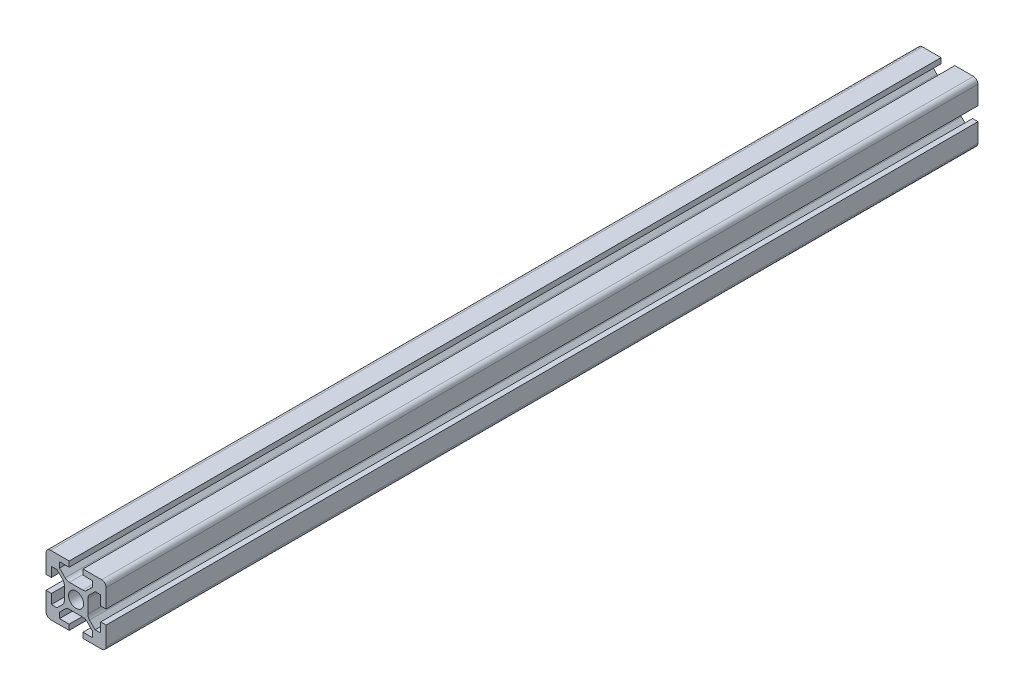
from build123d import *

# Parameters (mm, degrees)
SALIENTE_EXTRUIR1_DEPTH = 290


with BuildPart() as part:
    # Croquis1 → Saliente-Extruir1 (new body)
    with BuildSketch(Plane.XY):
        with BuildLine():
            Line((-10, 8.5), (-10, 2.3))
            Line((-10, 2.3), (-8.2, 2.3))
            Line((-8.2, 2.3), (-8.2, 5.5))
            Line((-8.2, 5.5), (-6.348528137, 5.5))
            Line((-6.348528137, 5.5), (-4.485786438, 3.6372583))
            ThreePointArc((-4.485786438, 3.6372583), (-4.052240935, 2.988411603), (-3.9, 2.223044738))
            Line((-3.9, 2.223044738), (-3.9, 0))
            Line((-3.9, 0), (-3.9, -2.223044738))
            ThreePointArc((-3.9, -2.223044738), (-4.052240935, -2.988411603), (-4.485786438, -3.6372583))
            Line((-4.485786438, -3.6372583), (-6.348528137, -5.5))
            Line((-6.348528137, -5.5), (-8.2, -5.5))
            Line((-8.2, -5.5), (-8.2, -2.3))
            Line((-8.2, -2.3), (-10, -2.3))
            Line((-10, -2.3), (-10, -8.5))
            ThreePointArc((-10, -8.5), (-9.560660172, -9.560660172), (-8.5, -10))
            Line((-8.5, -10), (-2.3, -10))
            Line((-2.3, -10), (-2.3, -8.2))
            Line((-2.3, -8.2), (-5.5, -8.2))
            Line((-5.5, -8.2), (-5.5, -6.348528137))
            Line((-5.5, -6.348528137), (-3.6372583, -4.485786438))
            ThreePointArc((-3.6372583, -4.485786438), (-2.988411603, -4.052240935), (-2.223044738, -3.9))
            Line((-2.223044738, -3.9), (0, -3.9))
            Line((0, -3.9), (2.223044738, -3.9))
            ThreePointArc((2.223044738, -3.9), (2.988411603, -4.052240935), (3.6372583, -4.485786438))
            Line((3.6372583, -4.485786438), (5.5, -6.348528137))
            Line((5.5, -6.348528137), (5.5, -8.2))
            Line((5.5, -8.2), (2.3, -8.2))
            Line((2.3, -8.2), (2.3, -10))
            Line((2.3, -10), (8.5, -10))
            ThreePointArc((8.5, -10), (9.560660172, -9.560660172), (10, -8.5))
            Line((10, -8.5), (10, -2.3))
            Line((10, -2.3), (8.2, -2.3))
            Line((8.2, -2.3), (8.2, -5.5))
            Line((8.2, -5.5), (6.348528137, -5.5))
            Line((6.348528137, -5.5), (4.485786438, -3.6372583))
            ThreePointArc((4.485786438, -3.6372583), (4.052240935, -2.988411603), (3.9, -2.223044738))
            Line((3.9, -2.223044738), (3.9, 0))
            Line((3.9, 0), (3.9, 2.223044738))
            ThreePointArc((3.9, 2.223044738), (4.052240935, 2.988411603), (4.485786438, 3.6372583))
            Line((4.485786438, 3.6372583), (6.348528137, 5.5))
            Line((6.348528137, 5.5), (8.2, 5.5))
            Line((8.2, 5.5), (8.2, 2.3))
            Line((8.2, 2.3), (10, 2.3))
            Line((10, 2.3), (10, 8.5))
            ThreePointArc((10, 8.5), (9.560660172, 9.560660172), (8.5, 10))
            Line((8.5, 10), (2.3, 10))
            Line((2.3, 10), (2.3, 8.2))
            Line((2.3, 8.2), (5.5, 8.2))
            Line((5.5, 8.2), (5.5, 6.348528137))
            Line((5.5, 6.348528137), (3.6372583, 4.485786438))
            ThreePointArc((3.6372583, 4.485786438), (2.988411603, 4.052240935), (2.223044738, 3.9))
            Line((2.223044738, 3.9), (0, 3.9))
            Line((0, 3.9), (-2.223044738, 3.9))
            ThreePointArc((-2.223044738, 3.9), (-2.988411603, 4.052240935), (-3.6372583, 4.485786438))
            Line((-3.6372583, 4.485786438), (-5.5, 6.348528137))
            Line((-5.5, 6.348528137), (-5.5, 8.2))
            Line((-5.5, 8.2), (-2.3, 8.2))
            Line((-2.3, 8.2), (-2.3, 10))
            Line((-2.3, 10), (-8.5, 10))
            ThreePointArc((-8.5, 10), (-9.560660172, 9.560660172), (-10, 8.5))
        make_face()
        with BuildLine():
            ThreePointArc((0, 2.5), (-1.767766953, 1.767766953), (-2.5, 0))
            ThreePointArc((-2.5, 0), (-1.767766953, -1.767766953), (0, -2.5))
            ThreePointArc((0, -2.5), (1.767766953, -1.767766953), (2.5, 0))
            ThreePointArc((2.5, 0), (1.767766953, 1.767766953), (0, 2.5))
        make_face(mode=Mode.SUBTRACT)
    extrude(amount=SALIENTE_EXTRUIR1_DEPTH)


solid = part.part
